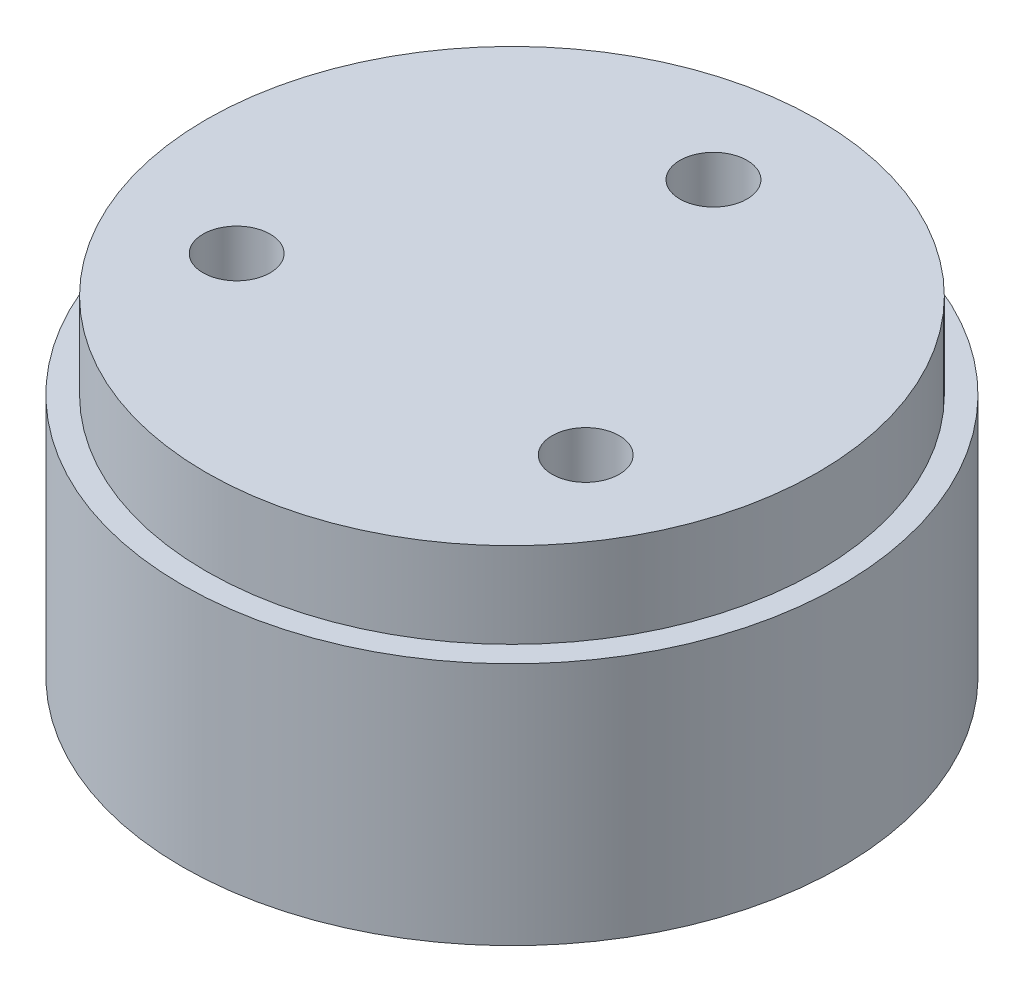
from build123d import *

# Parameters (mm, degrees)
SKETCH2_R            = 27
BOSS_EXTRUDE2_DEPTH  = 27
M5_CLEARANCE_HOLE1_D = 5.5
CUT_EXTRUDE1_START   = -7
SKETCH10_R           = 27
SKETCH10_R_2         = 25.05
CUT_EXTRUDE1_DEPTH   = 7


with BuildPart() as part:
    # Sketch2 → Boss-Extrude2 (new body)
    with BuildSketch(Plane(origin=(0, 0, 0), x_dir=(1, 0, 0), z_dir=(0, 1, 0))):
        with Locations(Location((0, 0, 0), (0, 0, 270))):
            Circle(SKETCH2_R)
    extrude(amount=BOSS_EXTRUDE2_DEPTH)

    # M5 Clearance Hole1 (through all)
    with Locations(Plane(origin=(0, 0, 0), x_dir=(-1, 0, 0), z_dir=(0, -1, 0))):
        with Locations((14.298079416, -8.255), (0, 16.51), (-14.298079416, -8.255)):
            Hole(M5_CLEARANCE_HOLE1_D / 2)

    # Sketch10 → Cut-Extrude1 (cut)
    with BuildSketch(Plane(origin=(0, 27, 0), x_dir=(1, 0, 0), z_dir=(0, 1, 0)).offset(CUT_EXTRUDE1_START)):
        with Locations(Location((0, 0, 0), (0, 0, 270))):
            Circle(SKETCH10_R)
        with Locations(Location((0, 0, 0), (0, 0, 270))):
            Circle(SKETCH10_R_2, mode=Mode.SUBTRACT)
    extrude(amount=CUT_EXTRUDE1_DEPTH, mode=Mode.SUBTRACT)


solid = part.part
